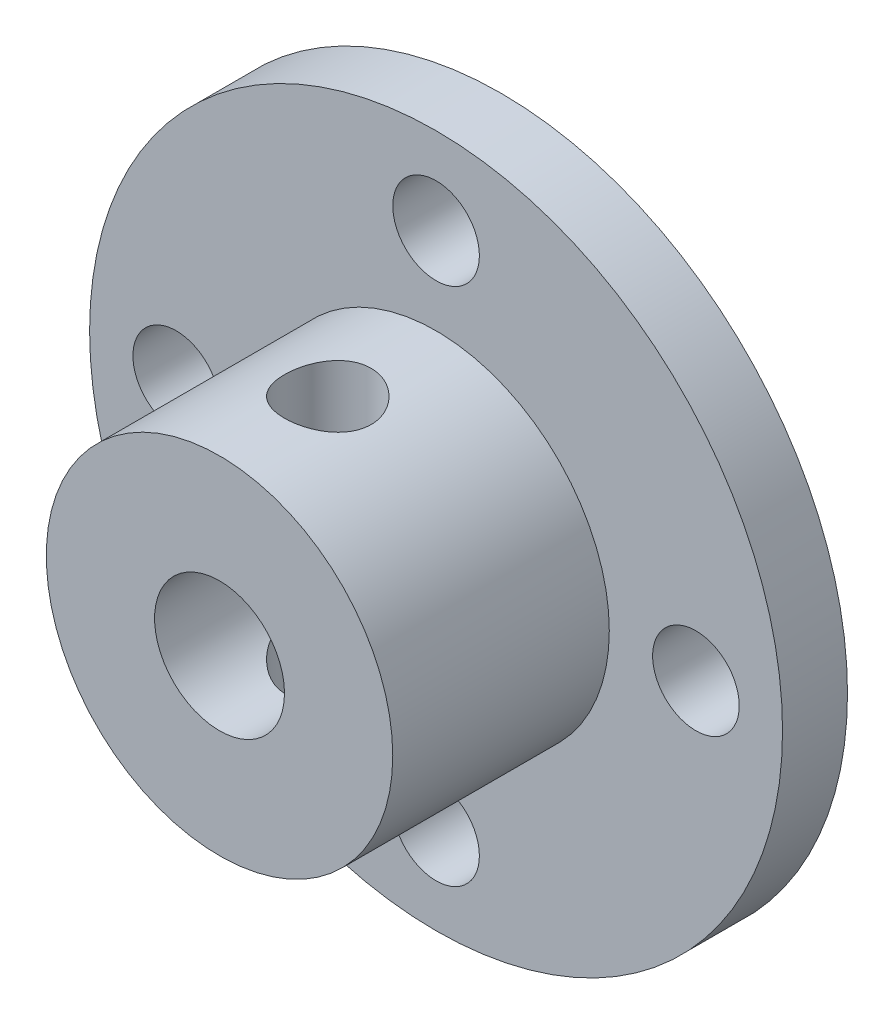
from build123d import *

# Parameters (mm, degrees)
SKETCH1_R               = 16
BOSS_EXTRUDE1_DEPTH     = 3
SKETCH2_R               = 8
SKETCH2_R_2             = 3
BOSS_EXTRUDE2_DEPTH     = 10
SKETCH3_R               = 2
CUT_EXTRUDE1_DEPTH      = 25.738633754
CUT_EXTRUDE2_DEPTH      = 27.095976701
CUT_EXTRUDE2_DEPTH_BACK = 27.095976701
SKETCH4_R               = 2


with BuildPart() as part:
    # Sketch1 → Boss-Extrude1 (new body)
    with BuildSketch(Plane.XY):
        Circle(SKETCH1_R)
    extrude(amount=BOSS_EXTRUDE1_DEPTH)

    # Sketch2 → Boss-Extrude2 (add)
    with BuildSketch(Plane.XY.offset(3)):
        Circle(SKETCH2_R)
        Circle(SKETCH2_R_2, mode=Mode.SUBTRACT)
    extrude(amount=BOSS_EXTRUDE2_DEPTH)

    # Sketch3 → Cut-Extrude1 (cut, through all)
    with BuildSketch(Plane.XY.offset(3)):
        with Locations((0, 12)):
            Circle(SKETCH3_R)
        with Locations((12, 0)):
            Circle(SKETCH3_R)
        with Locations((0, -12)):
            Circle(SKETCH3_R)
        with Locations((-12, 0)):
            Circle(SKETCH3_R)
    extrude(amount=-CUT_EXTRUDE1_DEPTH, mode=Mode.SUBTRACT)

    # Sketch4 → Cut-Extrude2 (cut, two sides: drawn at the far end of the back side and taken through both)
    with BuildSketch(Plane(origin=(0, 0, 0), x_dir=(1, 0, 0), z_dir=(0, 1, 0)).offset(-CUT_EXTRUDE2_DEPTH_BACK)):
        with Locations(Location((0, -8, 0), (0, 0, 270))):
            Circle(SKETCH4_R)
    extrude(amount=CUT_EXTRUDE2_DEPTH + CUT_EXTRUDE2_DEPTH_BACK, mode=Mode.SUBTRACT)


solid = part.part
